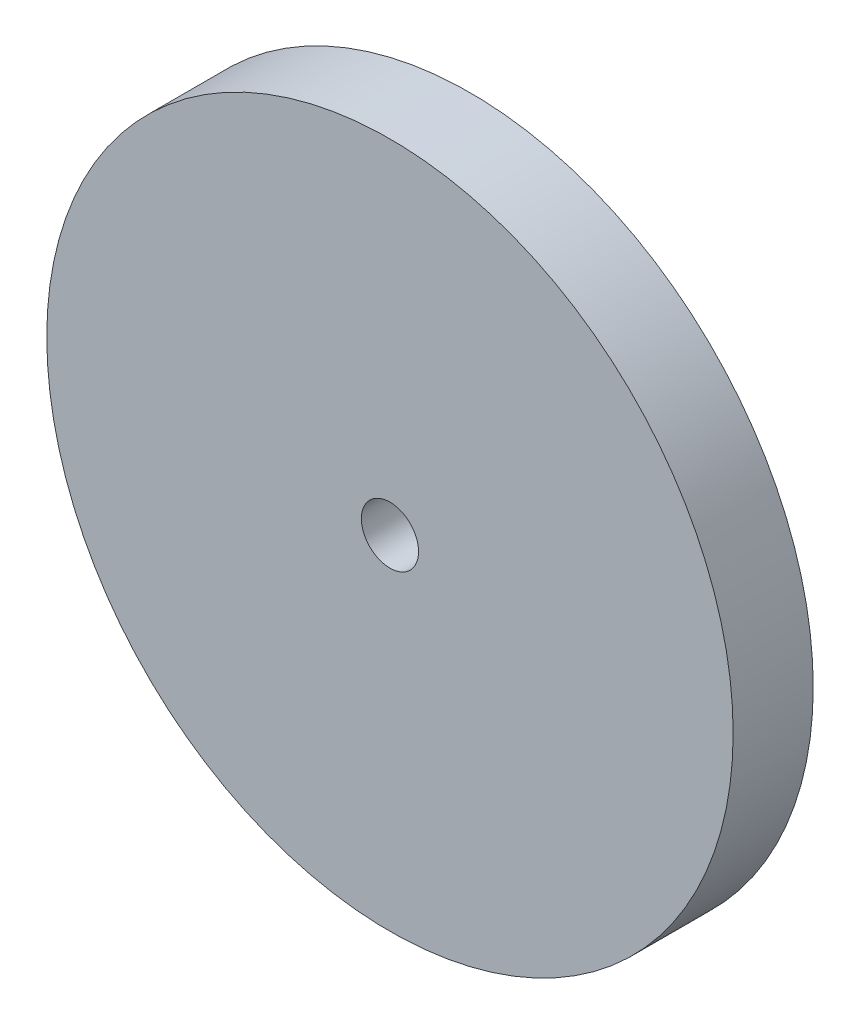
from build123d import *

# Parameters (mm, degrees)
SKETCH_1_R      = 30
SKETCH_1_R_2    = 2.5
EXTRUDE_2_DEPTH = 7


with BuildPart() as part:
    # Эскиз1 → Бобышка-Вытянуть2 (new body)
    with BuildSketch(Plane.XY):
        Circle(SKETCH_1_R)
        Circle(SKETCH_1_R_2, mode=Mode.SUBTRACT)
    extrude(amount=-EXTRUDE_2_DEPTH)


solid = part.part
